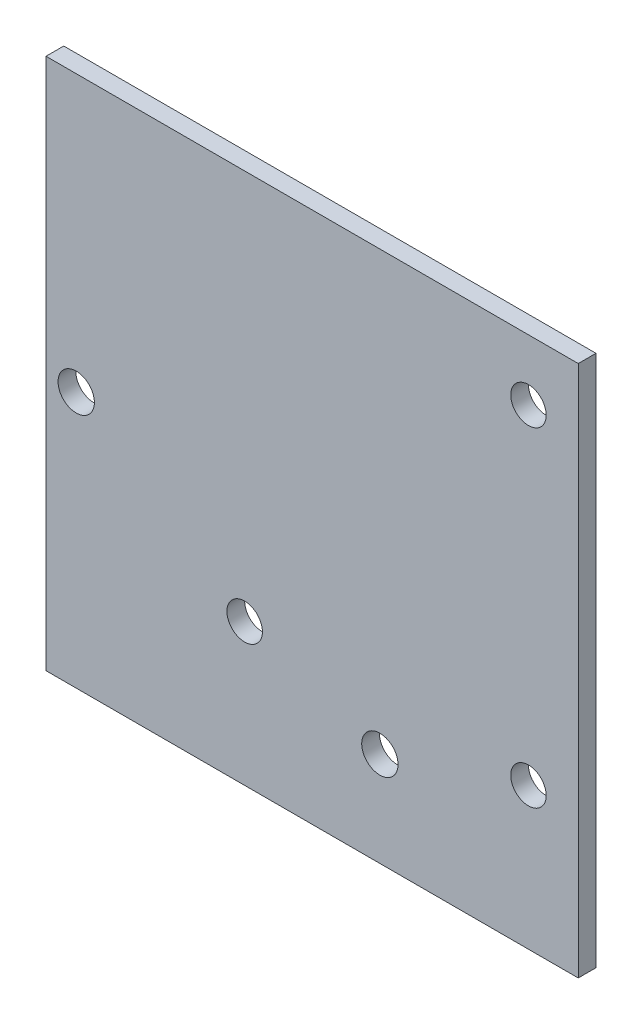
from build123d import *

# Parameters (mm, degrees)
SKETCH1_W           = 95.27402969
SKETCH1_H           = 95.257266492
SKETCH1_R           = 3.175
SKETCH1_R_2         = 3.2512
BOSS_EXTRUDE1_DEPTH = 3.175


with BuildPart() as part:
    # Sketch1 → Boss-Extrude1 (new body)
    with BuildSketch(Plane.XY):
        with Locations((-64.122985155, 140.157204675)):
            Rectangle(SKETCH1_W, SKETCH1_H)
        with Locations((-25.4, 176.892857143)):
            Circle(SKETCH1_R, mode=Mode.SUBTRACT)
        with Locations((-25.4, 117.928571429)):
            Circle(SKETCH1_R, mode=Mode.SUBTRACT)
        with Locations((-76.2, 117.928571429)):
            Circle(SKETCH1_R, mode=Mode.SUBTRACT)
        with Locations((-51.997945025, 109.474)):
            Circle(SKETCH1_R_2, mode=Mode.SUBTRACT)
        with Locations((-106.353945025, 138.43)):
            Circle(SKETCH1_R_2, mode=Mode.SUBTRACT)
    extrude(amount=BOSS_EXTRUDE1_DEPTH)


solid = part.part
